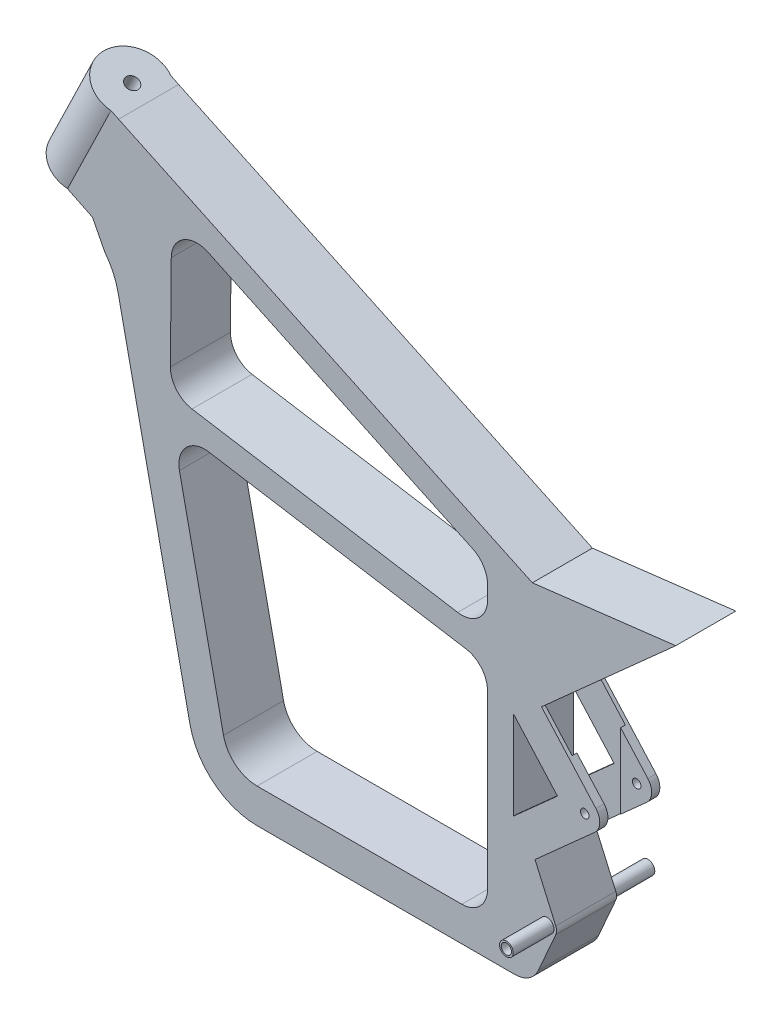
from build123d import *

# Parameters (mm, degrees)
SKETCH_1_R          = 5
SKETCH_1_R_2        = 8
EXTRUDE_1_DEPTH     = 35
SKETCH_2_R          = 8
SKETCH_2_R_2        = 6
EXTRUDE_2_DEPTH     = 82.5
SKETCH_3_W          = 42.302016602
SKETCH_3_H          = 114.861822868
CUT_EXTRUDE_1_DEPTH = 25.5
SKETCH_4_W          = 64.639494707
SKETCH_4_H          = 157.942491396
CUT_EXTRUDE_2_DEPTH = 31
SKETCH_5_R          = 36.84087404
SKETCH_5_R_2        = 7.5
EXTRUDE_3_DEPTH     = 128.2
CUT_EXTRUDE_3_DEPTH = 64


with BuildPart() as part:
    # Эскиз1 → Бобышка-Вытянуть1 (new, symmetric)
    with BuildSketch(Plane.XY):
        with BuildLine():
            Line((46.485752599, 163.525957525), (-16.969355429, 234.506193035))
            Line((-16.969355429, 234.506193035), (139.491938283, 374.379894827))
            Line((139.491938283, 374.379894827), (-27.598469683, 354.342788957))
            Line((-27.598469683, 354.342788957), (-509.881731069, 581.127761724))
            Line((-509.881731069, 581.127761724), (-518.721104493, 585.424916142))
            Line((-518.721104493, 585.424916142), (-574.35237116, 470.989759218))
            Line((-574.35237116, 470.989759218), (-563.968249487, 466.106813988))
            Line((-563.968249487, 466.106813988), (-554.670789116, 461.734851563))
            ThreePointArc((-554.670789116, 461.734851563), (-526.024716524, 439.039773197), (-510.461622358, 405.972354837))
            Line((-510.461622358, 405.972354837), (-426.739911846, 12.092674745))
            ThreePointArc((-426.739911846, 12.092674745), (-398.833735071, -33.446066906), (-348.488103787, -51.27438999))
            Line((-348.488103787, -51.27438999), (-48.06941217, -51.27438999))
            ThreePointArc((-48.06941217, -51.27438999), (-31.671926194, -46.396540648), (-20.606737964, -33.349220236))
            Line((-20.606737964, -33.349220236), (-0.352735385, 12.715946965))
            ThreePointArc((-0.352735385, 12.715946965), (0.577617407, 17.143384722), (-0.352735385, 21.570822479))
            Line((-0.352735385, 21.570822479), (-24.532087898, 76.563701639))
            Line((-24.532087898, 76.563701639), (45.102587172, 138.81590181))
            ThreePointArc((45.102587172, 138.81590181), (50.911789988, 150.884466728), (46.485752599, 163.525957525))
        make_face()
        with Locations((33.439142029, 151.862512381)):
            Circle(SKETCH_1_R, mode=Mode.SUBTRACT)
        with Locations((-10.422382593, 17.143384722)):
            Circle(SKETCH_1_R_2, mode=Mode.SUBTRACT)
        Polygon((1.669070396, 153.64086793), (-49.881296122, 211.304581219), (-49.881296122, 107.555728133), align=None, mode=Mode.SUBTRACT)
        with BuildLine():
            Line((-424.341826107, 331.410461473), (-130.558293442, 283.519373673))
            Line((-130.558293442, 283.519373673), (-114.7080306, 280.935544953))
            ThreePointArc((-114.7080306, 280.935544953), (-90.449389812, 287.688615998), (-79.881296122, 310.544709653))
            Line((-79.881296122, 310.544709653), (-79.881296122, 326.732272667))
            ThreePointArc((-79.881296122, 326.732272667), (-84.553646066, 342.810523277), (-97.115305634, 353.880559664))
            Line((-97.115305634, 353.880559664), (-106.521117185, 358.30347227))
            Line((-106.521117185, 358.30347227), (-405.741591683, 499.006483537))
            ThreePointArc((-405.741591683, 499.006483537), (-434.47055763, 497.258657451), (-448.506342859, 472.130881716))
            Line((-448.506342859, 472.130881716), (-449.513852316, 361.29231135))
            ThreePointArc((-449.513852316, 361.29231135), (-442.459263359, 341.691796922), (-424.341826107, 331.410461473))
        make_face(mode=Mode.SUBTRACT)
        with BuildLine():
            Line((-438.961647095, 261.980792175), (-387.614007817, 20.409142377))
            ThreePointArc((-387.614007817, 20.409142377), (-373.660919429, -2.360228448), (-348.488103787, -11.27438999))
            Line((-348.488103787, -11.27438999), (-109.881296122, -11.27438999))
            ThreePointArc((-109.881296122, -11.27438999), (-88.668092686, -2.487593425), (-79.881296122, 18.72561001))
            Line((-79.881296122, 18.72561001), (-79.881296122, 219.356726902))
            ThreePointArc((-79.881296122, 219.356726902), (-87.025202466, 238.788633212), (-105.054561643, 248.965891603))
            Line((-105.054561643, 248.965891603), (-404.790484594, 297.8273076))
            ThreePointArc((-404.790484594, 297.8273076), (-431.331787712, 288.917841178), (-438.961647095, 261.980792175))
        make_face(mode=Mode.SUBTRACT)
    extrude(amount=EXTRUDE_1_DEPTH, both=True)

    # Эскиз2 → Бобышка-Вытянуть2 (add, symmetric)
    with BuildSketch(Plane.XY):
        with Locations((-10.422382593, 17.143384722)):
            Circle(SKETCH_2_R)
        with Locations((-10.422382593, 17.143384722)):
            Circle(SKETCH_2_R_2, mode=Mode.SUBTRACT)
    extrude(amount=EXTRUDE_2_DEPTH, both=True)

    # Эскиз3 → Вырез-Вытянуть1 (cut, symmetric)
    with BuildSketch(Plane.XY):
        with Locations((35.909206886, 152.283379398)):
            Rectangle(SKETCH_3_W, SKETCH_3_H)
    extrude(amount=CUT_EXTRUDE_1_DEPTH, both=True, mode=Mode.SUBTRACT)

    # Эскиз4 → Вырез-Вытянуть2 (cut, symmetric)
    with BuildSketch(Plane.XY):
        with Locations((-17.561548768, 155.534947337)):
            Rectangle(SKETCH_4_W, SKETCH_4_H)
    extrude(amount=CUT_EXTRUDE_2_DEPTH, both=True, mode=Mode.SUBTRACT)

    # Эскиз5 → Бобышка-Вытянуть3 (add)
    with BuildSketch(Plane(origin=(131.039320596, 269.551748755, 0), x_dir=(0.8993583813402204, -0.4372121932347024, 0), z_dir=(0.4372121932347024, 0.8993583813402204, 0))):
        with Locations(Location((-733.971084464, 0, 0), (0, 0, 180))):
            Circle(SKETCH_5_R)
        with Locations(Location((-733.971084464, 0, 0), (0, 0, 180))):
            Circle(SKETCH_5_R_2, mode=Mode.SUBTRACT)
    extrude(amount=-EXTRUDE_3_DEPTH)

    # Эскиз6 → Вырез-Вытянуть3 (cut, symmetric)
    with BuildSketch(Plane.XY):
        Polygon((-612.900055289, 502.26219729), (-540.3281869, 466.982261723), (-526.024716524, 439.039773197), (-623.276117578, 486.317364902), (-615.524730273, 502.26219729), align=None)
    extrude(amount=CUT_EXTRUDE_3_DEPTH, both=True, mode=Mode.SUBTRACT)


solid = part.part
